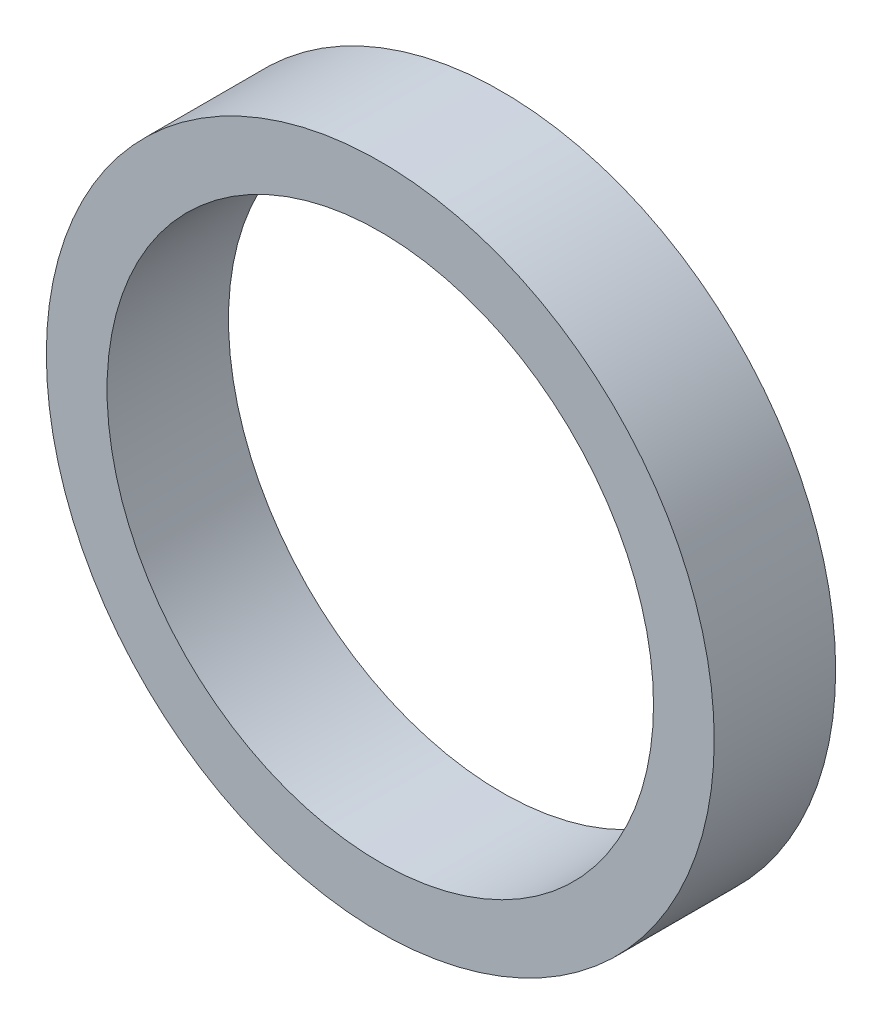
from build123d import *

# Parameters (mm, degrees)
BOSS_EXTRUDE1_DEPTH      = 12.7
BOSS_EXTRUDE1_DEPTH_BACK = 12.7
SKETCH3_R                = 69.85
SKETCH3_R_2              = 57.15


with BuildPart() as part:
    # Sketch3 → Boss-Extrude1 (new, two sides: drawn at the far end of the back side and taken through both)
    with BuildSketch(Plane.XY.offset(-BOSS_EXTRUDE1_DEPTH_BACK)):
        Circle(SKETCH3_R)
        Circle(SKETCH3_R_2, mode=Mode.SUBTRACT)
    extrude(amount=BOSS_EXTRUDE1_DEPTH + BOSS_EXTRUDE1_DEPTH_BACK)


solid = part.part
